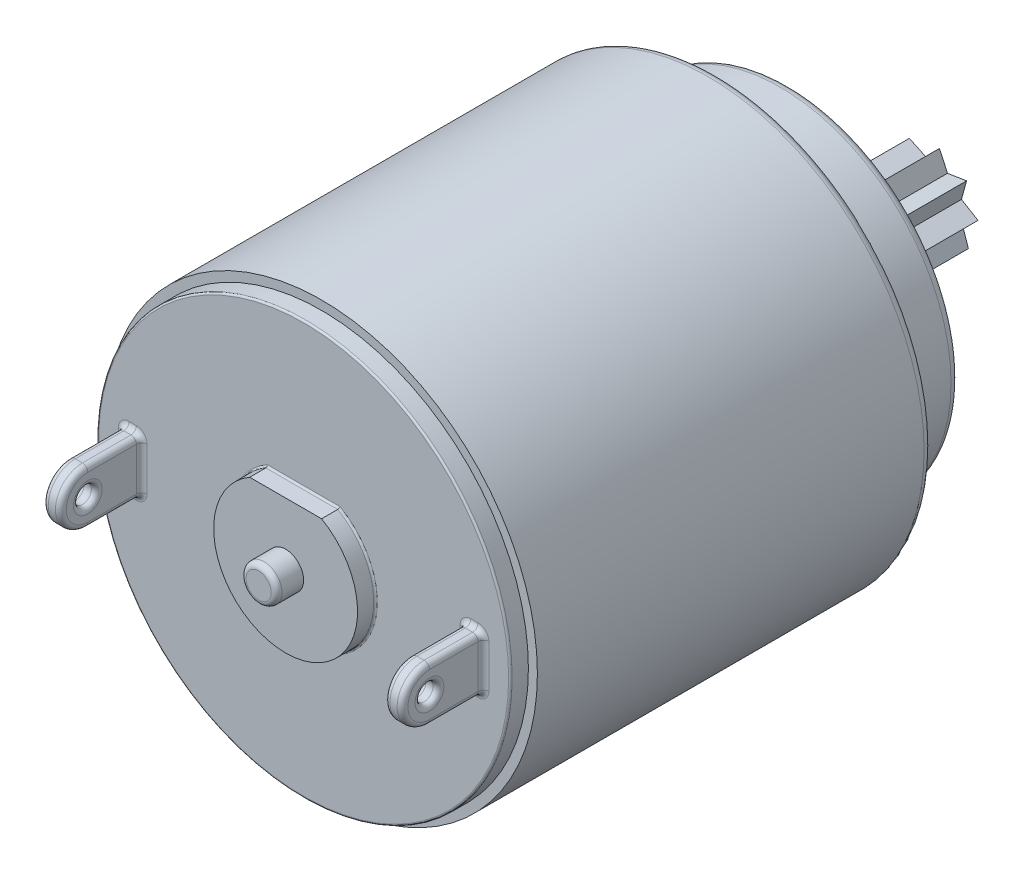
from build123d import *

# Parameters (mm, degrees)
SKETCH_1_R          = 12
EXTRUDE_1_DEPTH     = 22
SKETCH_2_R          = 11.5
EXTRUDE_2_DEPTH     = 1
EXTRUDE_3_DEPTH     = 1
SKETCH_4_R          = 1
EXTRUDE_4_DEPTH     = 1.5
SKETCH_5_W          = 1
SKETCH_5_H          = 3
EXTRUDE_5_DEPTH     = 3
SKETCH_6_R          = 1.5
EXTRUDE_6_DEPTH     = 1
SKETCH_7_R          = 0.5
CUT_EXTRUDE_1_DEPTH = 1
FILLET_3_R          = 0.3
FILLET_4_R          = 0.3
FILLET_5_R          = 0.1
SKETCH_8_R          = 9.5
EXTRUDE_7_DEPTH     = 4
SKETCH_9_R          = 3
EXTRUDE_8_DEPTH     = 1
EXTRUDE_START       = 7
SKETCH_10_R         = 1
EXTRUDE_9_DEPTH     = 7
EXTRUDE_10_DEPTH    = 4
FILLET_6_R          = 0.5


with BuildPart() as part:
    # Эскиз1 → Бобышка-Вытянуть1 (new body)
    with BuildSketch(Plane.XY):
        Circle(SKETCH_1_R)
    extrude(amount=EXTRUDE_1_DEPTH)

    # Эскиз2 → Бобышка-Вытянуть2 (add)
    with BuildSketch(Plane.XY.offset(22)):
        Circle(SKETCH_2_R)
    extrude(amount=EXTRUDE_2_DEPTH)

    # Эскиз3 → Бобышка-Вытянуть3 (add)
    with BuildSketch(Plane.XY.offset(23)):
        with BuildLine():
            Line((-2, 3.464101615), (2, 3.464101615))
            ThreePointArc((2, 3.464101615), (0, -4), (-2, 3.464101615))
        make_face()
    extrude(amount=EXTRUDE_3_DEPTH)

    # Эскиз4 → Бобышка-Вытянуть4 (add)
    with BuildSketch(Plane.XY.offset(24)):
        Circle(SKETCH_4_R)
    extrude(amount=EXTRUDE_4_DEPTH)

    # Эскиз5 → Бобышка-Вытянуть5 (add)
    with BuildSketch(Plane.XY.offset(23)):
        with Locations((9.5, 0)):
            Rectangle(SKETCH_5_W, SKETCH_5_H)
        with Locations((-9.5, 0)):
            Rectangle(SKETCH_5_W, SKETCH_5_H)
    extrude(amount=EXTRUDE_5_DEPTH)

    # Эскиз6 → Бобышка-Вытянуть6 (add)
    with BuildSketch(Plane(origin=(10, 0, 0), x_dir=(0, 0, -1), z_dir=(1, 0, 0))):
        with Locations((-26, 0)):
            Circle(SKETCH_6_R)
    extrude_6 = extrude(amount=-EXTRUDE_6_DEPTH)

    # Эскиз7 → Вырез-Вытянуть1 (cut)
    with BuildSketch(Plane(origin=(10, 0, 0), x_dir=(0, 0, -1), z_dir=(1, 0, 0))):
        with Locations((-26, 0)):
            Circle(SKETCH_7_R)
    cut_extrude_1 = extrude(amount=-CUT_EXTRUDE_1_DEPTH, mode=Mode.SUBTRACT)

    # Зеркальное отражение5: Бобышка-Вытянуть6, Вырез-Вытянуть1 across plane
    add(extrude_6.mirror(Plane(origin=(0, 0, 0), x_dir=(0, 0, 1), z_dir=(1, 0, 0))))
    add(cut_extrude_1.mirror(Plane(origin=(0, 0, 0), x_dir=(0, 0, 1), z_dir=(1, 0, 0))), mode=Mode.SUBTRACT)

    # Скругление3
    fillet_3_edges = [part.edges().sort_by_distance(p)[0] for p in [
        (-10, 0, 23),
        (-10, 1.5, 24.5),
        (-9.5, -1.5, 23),
        (-10, -1.5, 24.5),
        (-9, 0, 23),
        (-9, -1.5, 24.5),
        (-9.5, 1.5, 23),
        (-9, 1.5, 24.5),
        (10, 0, 23),
        (10, -1.5, 24.5),
        (9.5, 1.5, 23),
        (10, 1.5, 24.5),
        (9, 0, 23),
        (9, 1.5, 24.5),
        (9.5, -1.5, 23),
        (9, -1.5, 24.5),
        (9, 0, 27.5),
        (10, 0, 27.5),
        (9, 0, 26.5),
        (10, 0, 26.5),
        (-10, 0, 27.5),
        (-9, 0, 27.5),
        (-10, 0, 26.5),
        (-9, 0, 26.5),
    ]]
    fillet(fillet_3_edges, radius=FILLET_3_R)

    # Скругление4
    fillet_4_edges = [part.edges().sort_by_distance(p)[0] for p in [
        (-1, 0, 25.5),
    ]]
    fillet(fillet_4_edges, radius=FILLET_4_R)

    # Скругление5
    fillet_5_edges = [part.edges().sort_by_distance(p)[0] for p in [
        (0, -4, 23),
        (0, 3.464101615, 23),
        (-11.5, 0, 23),
    ]]
    fillet(fillet_5_edges, radius=FILLET_5_R)

    # Эскиз8 → Бобышка-Вытянуть7 (add)
    with BuildSketch(Plane(origin=(0, 0, 0), x_dir=(-1, 0, 0), z_dir=(0, 0, -1))):
        with Locations(Location((0, 0, 0), (0, 0, 180))):
            Circle(SKETCH_8_R)
    extrude(amount=EXTRUDE_7_DEPTH)

    # Эскиз9 → Бобышка-Вытянуть8 (add)
    with BuildSketch(Plane(origin=(0, 0, -4), x_dir=(-1, 0, 0), z_dir=(0, 0, -1))):
        Circle(SKETCH_9_R)
    extrude(amount=EXTRUDE_8_DEPTH)

    # Эскиз10 → Бобышка-Вытянуть9 (add)
    with BuildSketch(Plane(origin=(0, 0, -5), x_dir=(-1, 0, 0), z_dir=(0, 0, -1)).offset(EXTRUDE_START)):
        with Locations(Location((0, 0, 0), (0, 0, 180))):
            Circle(SKETCH_10_R)
    extrude(amount=-EXTRUDE_9_DEPTH)

    # Эскиз11 → Бобышка-Вытянуть10 (add)
    with BuildSketch(Plane(origin=(0, 0, -12), x_dir=(-1, 0, 0), z_dir=(0, 0, -1))):
        Polygon((-0.51238389, -2.446929249), (0.242160598, -1.686060157), (1.180346971, -2.20381057), (1.269284358, -1.135939182), (2.320780367, -0.929504433), (1.702495861, -0.054299639), (2.375294836, 0.779727159), (1.339090629, 1.052747308), (1.318382453, 2.124115747), (0.349110009, 1.66720209), (-0.355415732, 2.47460697), (-0.804223064, 1.501554485), (-1.862910946, 1.66720209), (-1.581251227, 0.633312849), (-2.498729424, 0.079694823), (-1.618394368, -0.531262908), (-1.965364635, -1.545102538), (-0.898272797, -1.447254846), align=None)
    extrude(amount=-EXTRUDE_10_DEPTH)

    # Скругление6
    fillet_6_edges = [part.edges().sort_by_distance(p)[0] for p in [
        (-9.5, 0, 0),
        (-9.5, 0, -4),
        (-12, 0, 0),
    ]]
    fillet(fillet_6_edges, radius=FILLET_6_R)


solid = part.part
